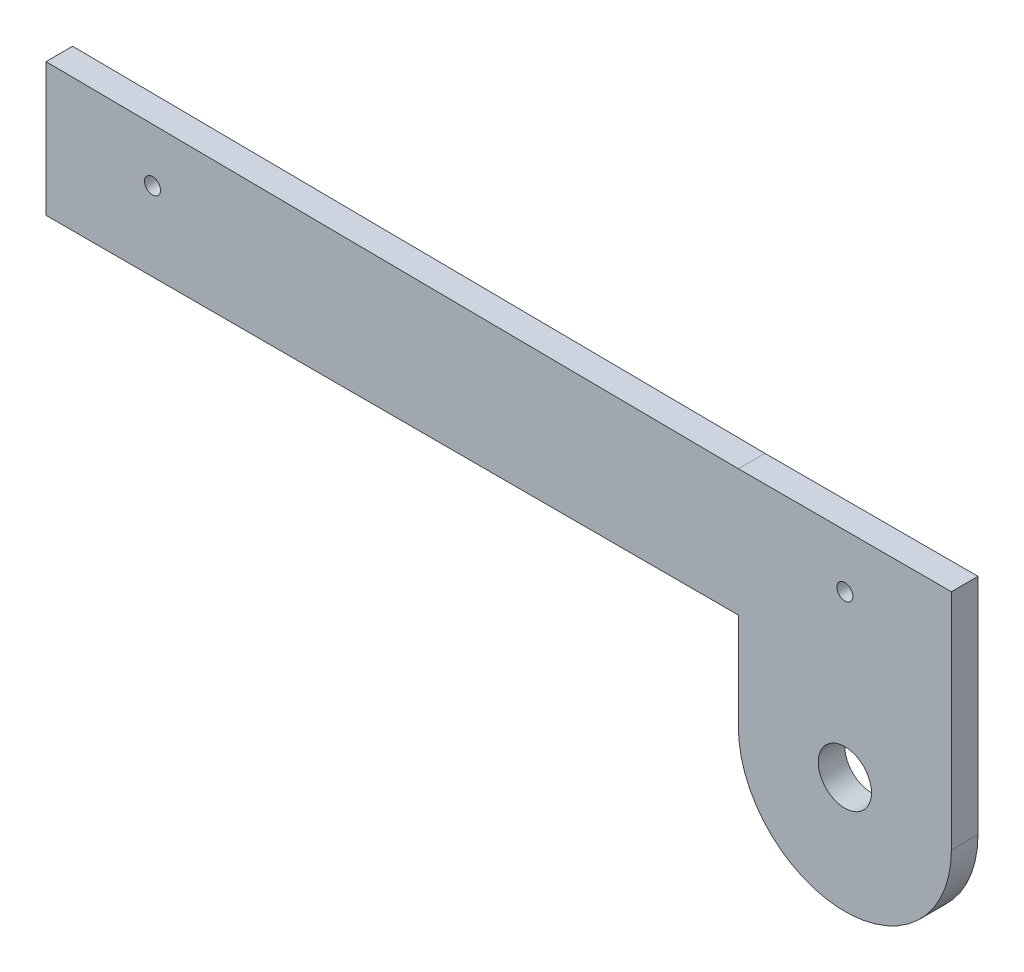
from build123d import *

# Parameters (mm, degrees)
SKETCH1_R               = 1.5
BOSS_EXTRUDE1_DEPTH     = 5
CUT_EXTRUDE1_DEPTH      = 37
CUT_EXTRUDE1_DEPTH_BACK = 24
SKETCH2_R               = 5


with BuildPart() as part:
    # Sketch1 → Boss-Extrude1 (new body)
    with BuildSketch(Plane.XY):
        with BuildLine():
            Line((-20, -76.707766284), (-20, -58.504148974))
            Line((-20, -58.504148974), (-150, -58.504148974))
            Line((-150, -58.504148974), (-150, -33.504148974))
            Line((-150, -33.504148974), (-20, -34.707766284))
            Line((-20, -34.707766284), (20, -34.707766284))
            Line((20, -34.707766284), (20, -76.707766284))
            ThreePointArc((20, -76.707766284), (0, -96.707766284), (-20, -76.707766284))
        make_face()
        with Locations((0, -44.707766284)):
            Circle(SKETCH1_R, mode=Mode.SUBTRACT)
        with Locations((-130, -43.689749466)):
            Circle(SKETCH1_R, mode=Mode.SUBTRACT)
    extrude(amount=BOSS_EXTRUDE1_DEPTH)

    # Sketch2 → Cut-Extrude1 (cut, two sides: drawn at the far end of the back side and taken through both)
    with BuildSketch(Plane.XY.offset(5).offset(-CUT_EXTRUDE1_DEPTH_BACK)):
        with Locations((0, -74.90788056)):
            Circle(SKETCH2_R)
    extrude(amount=CUT_EXTRUDE1_DEPTH + CUT_EXTRUDE1_DEPTH_BACK, mode=Mode.SUBTRACT)


solid = part.part
